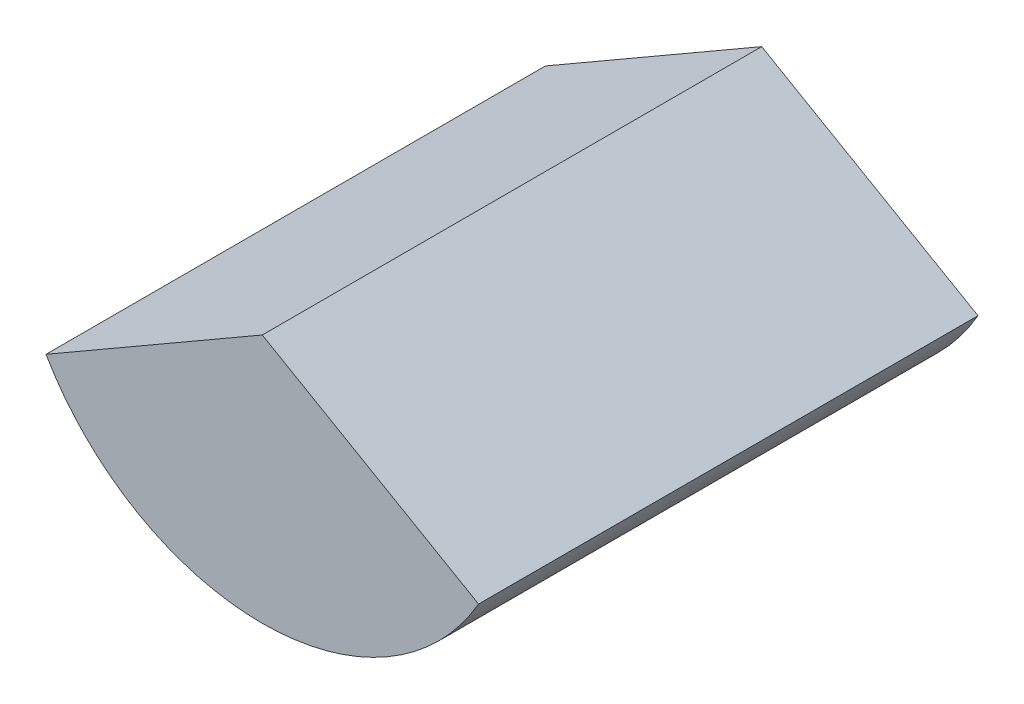
from build123d import *

# Parameters (mm, degrees)
SALIENTE_EXTRUIR1_DEPTH = 50
CROQUIS2_R              = 5
CORTAR_EXTRUIR1_DEPTH   = 10


with BuildPart() as part:
    # Croquis1 → Saliente-Extruir1 (new body)
    with BuildSketch(Plane.XY):
        with BuildLine():
            Line((0, 0), (-21.650635095, -12.5))
            ThreePointArc((-21.650635095, -12.5), (0, -25), (21.650635095, -12.5))
            Line((21.650635095, -12.5), (0, 0))
        make_face()
    extrude(amount=SALIENTE_EXTRUIR1_DEPTH)

    # Croquis2 → Cortar-Extruir1 (cut)
    with BuildSketch(Plane(origin=(0, 0, 0), x_dir=(-1, 0, 0), z_dir=(0, 0, -1))):
        with Locations((0, -13.611730672)):
            Circle(CROQUIS2_R)
    extrude(amount=-CORTAR_EXTRUIR1_DEPTH, mode=Mode.SUBTRACT)


solid = part.part
